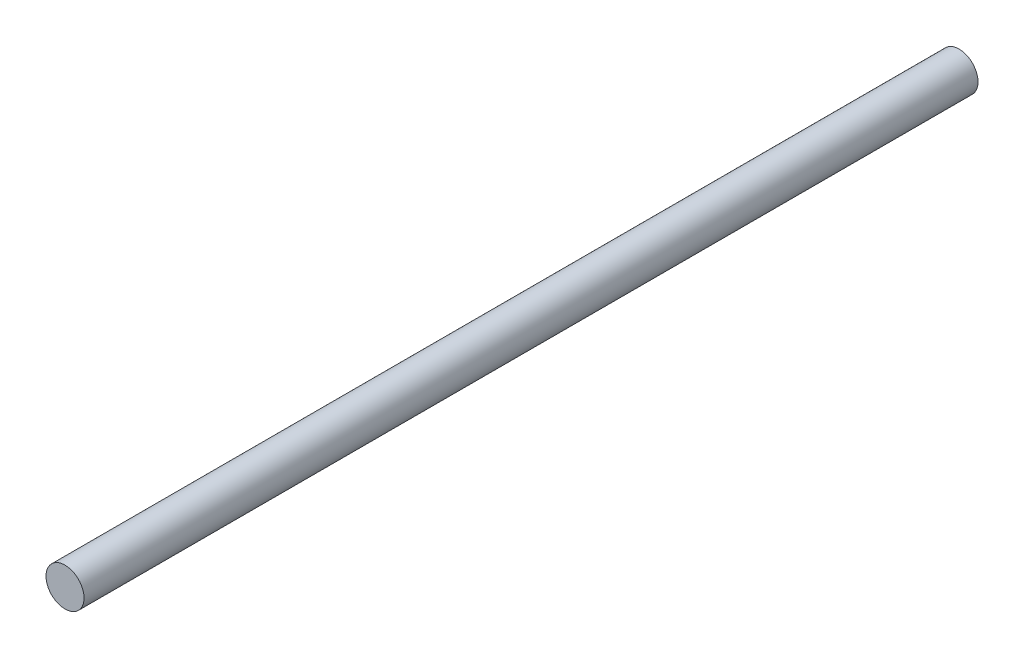
from build123d import *

# Parameters (mm, degrees)
SKETCH1_R           = 10
BOSS_EXTRUDE1_DEPTH = 470


with BuildPart() as part:
    # Sketch1 → Boss-Extrude1 (new body)
    with BuildSketch(Plane.XY):
        with Locations(Location((0, 0, 0), (0, 0, 180))):
            Circle(SKETCH1_R)
    extrude(amount=BOSS_EXTRUDE1_DEPTH)


solid = part.part
